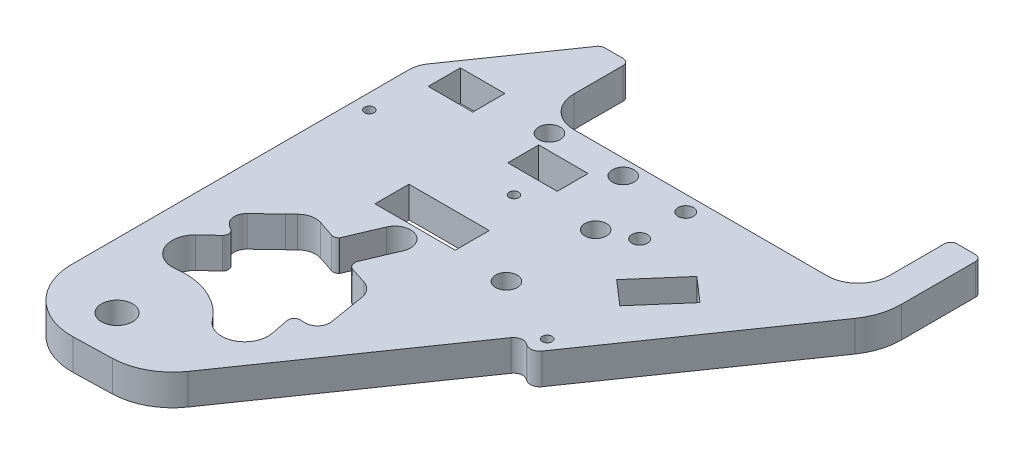
from build123d import *

# Parameters (mm, degrees)
DODANIE_WYCI_GNI_CIE1_DEPTH = 10
SZKIC5_R                    = 5.05
WYTNIJ_WYCI_GNI_CIE1_DEPTH  = 10
SZKIC9_R                    = 1.55
SZKIC9_W                    = 26
SZKIC9_H                    = 11
SZKIC9_W_2                  = 16
SZKIC9_H_2                  = 10
WYTNIJ_WYCI_GNI_CIE3_DEPTH  = 172.424567808
SZKIC13_R                   = 3.5
WYTNIJ_WYCI_GNI_CIE5_DEPTH  = 172.424567808
SZKIC19_W                   = 14.4
SZKIC19_H                   = 10.4
WYTNIJ_WYCI_GNI_CIE7_DEPTH  = 172.424567808
SZKIC20_R                   = 1.550000003
WYTNIJ_WYCI_GNI_CIE8_DEPTH  = 10
WYTNIJ_WYCI_GNI_CIE10_DEPTH = 10
WYTNIJ_WYCI_GNI_CIE11_DEPTH = 10
DODANIE_WYCI_GNI_CIE4_DEPTH = 10
SZKIC22_R                   = 1.55
WYTNIJ_WYCI_GNI_CIE9_DEPTH  = 10
WYTNIJ_WYCI_GNI_CIE6_DEPTH  = 172.424567808
WYTNIJ_WYCI_GNI_CIE12_DEPTH = 10
SZKIC30_R                   = 2.5
WYTNIJ_WYCI_GNI_CIE13_DEPTH = 10
WYTNIJ_WYCI_GNI_CIE14_DEPTH = 10


with BuildPart() as part:
    # Szkic2 → Dodanie-wyciągnięcie1 (new body)
    with BuildSketch(Plane(origin=(0, 0, 0), x_dir=(1, 0, 0), z_dir=(0, 1, 0))):
        with BuildLine():
            Line((-2.705874152, 127.916025413), (-8.705874152, 127.916025413))
            Line((-8.705874152, 127.916025413), (-8.722327105, 127.916025413))
            ThreePointArc((-8.722327105, 127.916025413), (-9.649740147, 127.688003136), (-10.365682355, 127.055930463))
            Line((-10.365682355, 127.055930463), (-32.779295153, 94.743126616))
            ThreePointArc((-32.779295153, 94.743126616), (-33.840904211, 92.57229607), (-34.205874152, 90.183506419))
            Line((-34.205874152, 90.183506419), (-34.205874152, -19.154356935))
            ThreePointArc((-34.205874152, -19.154356935), (-28.165753637, -33.476429577), (-13.693697675, -39.147797741))
            Line((-13.693697675, -39.147797741), (-2.713579886, -35.93445679))
            Line((-2.713579886, -35.93445679), (55.027168237, 21.545915465))
            ThreePointArc((55.027168237, 21.545915465), (56.334805154, 23.495770338), (56.794125848, 25.798132784))
            Line((56.794125848, 25.798132784), (56.794125848, 59.333926751))
            ThreePointArc((56.794125848, 59.333926751), (64.677605901, 81.048439594), (85.935948442, 90.090131813))
            Line((85.935948442, 90.090131813), (91.371133341, 90.090131813))
            ThreePointArc((91.371133341, 90.090131813), (105.458816444, 95.925441216), (111.294125848, 110.013124319))
            Line((111.294125848, 110.013124319), (111.294125848, 118.285035843))
            Line((111.294125848, 118.285035843), (111.294125848, 128))
            ThreePointArc((111.294125848, 128), (110.70833941, 129.414213562), (109.294125848, 130))
            Line((109.294125848, 130), (103.294125848, 130))
            ThreePointArc((103.294125848, 130), (101.879912285, 129.414213562), (101.294125848, 128))
            Line((101.294125848, 128), (101.294125848, 118.285035843))
            Line((101.294125848, 118.285035843), (101.294125848, 110))
            ThreePointArc((101.294125848, 110), (98.36519366, 102.928932188), (91.294125848, 100))
            Line((91.294125848, 100), (9.294125848, 100))
            ThreePointArc((9.294125848, 100), (2.223058036, 102.928932188), (-0.705874152, 110))
            Line((-0.705874152, 110), (-0.705874152, 125.916025413))
            ThreePointArc((-0.705874152, 125.916025413), (-1.291660589, 127.330238976), (-2.705874152, 127.916025413))
        make_face()
    extrude(amount=DODANIE_WYCI_GNI_CIE1_DEPTH)

    # Szkic5 → Wytnij-wyciągnięcie1 (cut)
    with BuildSketch(Plane(origin=(0, 10, 0), x_dir=(1, 0, 0), z_dir=(0, 1, 0))):
        with Locations(Location((-13.29618586, -25.303913492, 0), (0, 0, 270))):
            Circle(SZKIC5_R)
    extrude(amount=-WYTNIJ_WYCI_GNI_CIE1_DEPTH, mode=Mode.SUBTRACT)

    # Szkic9 → Wytnij-wyciągnięcie3 (cut, through all)
    with BuildSketch(Plane(origin=(0, 10, 0), x_dir=(1, 0, 0), z_dir=(0, 1, 0))):
        with Locations(Location((17.894125848, 72, 0), (0, 0, 270))):
            Circle(SZKIC9_R)
        with Locations((10.894125848, 52.5)):
            Rectangle(SZKIC9_W, SZKIC9_H)
        with Locations((15.894125848, 85)):
            Rectangle(SZKIC9_W_2, SZKIC9_H_2)
    extrude(amount=-WYTNIJ_WYCI_GNI_CIE3_DEPTH, mode=Mode.SUBTRACT)

    # Szkic13 → Wytnij-wyciągnięcie5 (cut, through all)
    with BuildSketch(Plane(origin=(0, 10, 0), x_dir=(1, 0, 0), z_dir=(0, 1, 0))):
        with Locations(Location((40.894125848, 75.45, 0), (0, 0, 270))):
            Circle(SZKIC13_R)
        with Locations(Location((40.894125848, 46.55, 0), (0, 0, 270))):
            Circle(SZKIC13_R)
        with Locations(Location((30.260526653, 95, 0), (0, 0, 270))):
            Circle(SZKIC13_R)
        with Locations(Location((6.36054282, 95, 0), (0, 0, 270))):
            Circle(SZKIC13_R)
    extrude(amount=-WYTNIJ_WYCI_GNI_CIE5_DEPTH, mode=Mode.SUBTRACT)

    # Szkic19 → Wytnij-wyciągnięcie7 (cut, through all)
    with BuildSketch(Plane(origin=(0, 10, 0), x_dir=(1, 0, 0), z_dir=(0, 1, 0))):
        with Locations((-19.205874152, 93.746086503)):
            Rectangle(SZKIC19_W, SZKIC19_H)
    extrude(amount=-WYTNIJ_WYCI_GNI_CIE7_DEPTH, mode=Mode.SUBTRACT)

    # Szkic20 → Wytnij-wyciągnięcie8 (cut)
    with BuildSketch(Plane.XZ):
        with Locations(Location((-29.337186678, -72.387878862, 0), (0, 0, 270))):
            Circle(SZKIC20_R)
    extrude(amount=-WYTNIJ_WYCI_GNI_CIE8_DEPTH, mode=Mode.SUBTRACT)

    # Szkic23 → Wytnij-wyciągnięcie10 (cut)
    with BuildSketch(Plane(origin=(0, 10, 0), x_dir=(1, 0, 0), z_dir=(0, 1, 0))):
        with BuildLine():
            Line((15.628724602, 38.350669498), (8.597420665, 21.889479841))
            Line((8.597420665, 21.889479841), (-0.782698582, 25.896144654))
            Line((-0.782698582, 25.896144654), (6.248605356, 42.357334312))
            ThreePointArc((6.248605356, 42.357334312), (12.941997386, 45.044061528), (15.628724602, 38.350669498))
        make_face()
    extrude(amount=-WYTNIJ_WYCI_GNI_CIE10_DEPTH, mode=Mode.SUBTRACT)

    # Szkic25 → Wytnij-wyciągnięcie11 (cut)
    with BuildSketch(Plane(origin=(0, 10, 0), x_dir=(1, 0, 0), z_dir=(0, 1, 0))):
        with BuildLine():
            Line((1.679385524, 31.66020119), (3.469714538, 35.85159239))
            Line((3.469714538, 35.85159239), (3.704708682, 36.109613041))
            ThreePointArc((3.704708682, 36.109613041), (9.518980065, 39.386499344), (13.410780858, 33.964541935))
            Line((13.410780858, 33.964541935), (13.39199801, 33.114203976))
            Line((13.39199801, 33.114203976), (12.051775457, 29.976570072))
            Line((12.051775457, 29.976570072), (11.05950477, 27.653536376))
            Line((11.05950477, 27.653536376), (17.589964961, -6.167500607))
            ThreePointArc((17.589964961, -6.167500607), (13.061179445, -14.403704543), (4.044681841, -11.748949479))
            ThreePointArc((4.044681841, -11.748949479), (-4.827370085, -4.988355381), (-15.874459375, -3.445385461))
            ThreePointArc((-15.874459375, -3.445385461), (-23.818044234, 0.469833912), (-22.492396316, 9.226096856))
            Line((-22.492396316, 9.226096856), (1.679385524, 31.66020119))
        make_face()
    extrude(amount=-WYTNIJ_WYCI_GNI_CIE11_DEPTH, mode=Mode.SUBTRACT)

    # Szkic27 → Dodanie-wyciągnięcie4 (add)
    with BuildSketch(Plane.XZ):
        with BuildLine():
            Line((111.294125848, -110.013124319), (91.371133341, -90.090131813))
            Line((91.371133341, -90.090131813), (85.935948442, -90.090131813))
            ThreePointArc((85.935948442, -90.090131813), (64.677605901, -81.048439594), (56.794125848, -59.333926751))
            Line((56.794125848, -59.333926751), (56.794125848, -25.798132784))
            Line((56.794125848, -25.798132784), (55.027168237, -21.545915465))
            Line((55.027168237, -21.545915465), (-2.713579886, 35.93445679))
            Line((-2.713579886, 35.93445679), (-13.693697675, 39.147797741))
            Line((-13.693697675, 39.147797741), (7.831109821, 38.596391899))
            ThreePointArc((7.831109821, 38.596391899), (16.200857661, 35.992910672), (22.653502952, 30.060443886))
            Line((22.653502952, 30.060443886), (62.775344571, -27.781601032))
            Line((62.775344571, -27.781601032), (89.166132073, -65.828137643))
            Line((89.166132073, -65.828137643), (107.72767835, -92.58757216))
            ThreePointArc((107.72767835, -92.58757216), (110.381700996, -98.014648527), (111.294125848, -103.986622655))
            Line((111.294125848, -103.986622655), (111.294125848, -110.013124319))
        make_face()
    extrude(amount=-DODANIE_WYCI_GNI_CIE4_DEPTH)

    # Szkic22 → Wytnij-wyciągnięcie9 (cut)
    with BuildSketch(Plane.XZ):
        with Locations(Location((63.668699874, -36.964909883, 0), (0, 0, 270))):
            Circle(SZKIC22_R)
    extrude(amount=-WYTNIJ_WYCI_GNI_CIE9_DEPTH, mode=Mode.SUBTRACT)

    # Szkic17 → Wytnij-wyciągnięcie6 (cut, through all)
    with BuildSketch(Plane(origin=(0, 10, 0), x_dir=(1, 0, 0), z_dir=(0, 1, 0))):
        Polygon((66.124221849, 58.029118396), (78.203911754, 71.908638986), (70.358965334, 78.736289802), (58.279275429, 64.856769212), align=None)
    extrude(amount=-WYTNIJ_WYCI_GNI_CIE6_DEPTH, mode=Mode.SUBTRACT)

    # Szkic28 → Wytnij-wyciągnięcie12 (cut)
    with BuildSketch(Plane(origin=(0, 10, 0), x_dir=(1, 0, 0), z_dir=(0, 1, 0))):
        with BuildLine():
            Line((11.26748333, 26.576422306), (10.066738772, 23.271111531))
            Line((10.066738772, 23.271111531), (13.650053515, 4.713243184))
            Line((13.650053515, 4.713243184), (14.443246416, -0.151068703))
            Line((14.443246416, -0.151068703), (16.401806069, -0.01406507))
            ThreePointArc((16.401806069, -0.01406507), (16.908780733, 1.735462564), (18.624084966, 2.348326041))
            ThreePointArc((18.624084966, 2.348326041), (19.396162916, 2.285491306), (20.170698513, 2.297622868))
            Line((20.170698513, 2.297622868), (20.24930544, 2.302668096))
            ThreePointArc((20.24930544, 2.302668096), (23.123159184, 3.803925799), (23.940405993, 6.941586981))
            Line((23.940405993, 6.941586981), (23.056429184, 12.118910521))
            Line((23.056429184, 12.118910521), (22.000864003, 18.666304586))
            ThreePointArc((22.000864003, 18.666304586), (20.623069051, 21.574602066), (17.93652414, 23.346321457))
            Line((17.93652414, 23.346321457), (12.620467249, 25.051129714))
            ThreePointArc((12.620467249, 25.051129714), (11.735014139, 25.628420704), (11.26748333, 26.576422306))
        make_face()
        with BuildLine():
            Line((-0.358990635, 31.193922826), (-5.655504297, 32.95851204))
            ThreePointArc((-5.655504297, 32.95851204), (-8.869808875, 33.115862726), (-11.699467807, 31.583040659))
            Line((-11.699467807, 31.583040659), (-13.721552832, 29.619702325))
            Line((-13.721552832, 29.619702325), (-20.075654798, 23.596300827))
            ThreePointArc((-20.075654798, 23.596300827), (-21.322767717, 20.6033893), (-19.942342747, 17.669580012))
            Line((-19.942342747, 17.669580012), (-19.882798357, 17.618014821))
            ThreePointArc((-19.882798357, 17.618014821), (-19.179679353, 17.074421967), (-18.420602931, 16.612174728))
            ThreePointArc((-18.420602931, 16.612174728), (-17.380074633, 15.099249316), (-18.012101151, 13.375246728))
            Line((-18.012101151, 13.375246728), (-18.878230506, 12.580445054))
            Line((-18.878230506, 12.580445054), (-17.460533124, 11.447059157))
            Line((-17.460533124, 11.447059157), (-13.203312435, 15.39161053))
            Line((-13.203312435, 15.39161053), (0.650139771, 28.249156335))
            Line((0.650139771, 28.249156335), (1.63370973, 31.625464518))
            ThreePointArc((1.63370973, 31.625464518), (0.696479646, 31.136698863), (-0.358990635, 31.193922826))
        make_face()
    extrude(amount=-WYTNIJ_WYCI_GNI_CIE12_DEPTH, mode=Mode.SUBTRACT)

    # Szkic30 → Wytnij-wyciągnięcie13 (cut)
    with BuildSketch(Plane.XZ):
        with Locations(Location((50.565790387, -80.001305931, 0), (0, 0, 270))):
            Circle(SZKIC30_R)
        with Locations(Location((50.48451947, -95.001085764, 0), (0, 0, 270))):
            Circle(SZKIC30_R)
    extrude(amount=-WYTNIJ_WYCI_GNI_CIE13_DEPTH, mode=Mode.SUBTRACT)

    # Szkic31 → Wytnij-wyciągnięcie14 (cut)
    with BuildSketch(Plane.XZ):
        with BuildLine():
            Line((14.621138887, 30.235921356), (57.465724426, -31.531393932))
            ThreePointArc((57.465724426, -31.531393932), (59.396767725, -32.773629705), (61.640614875, -32.286569233))
            Line((61.640614875, -32.286569233), (62.051453688, -32.00159297))
            ThreePointArc((62.051453688, -32.00159297), (64.295300838, -31.514532498), (66.226344137, -32.756768271))
            Line((66.226344137, -32.756768271), (22.653502952, 30.060443886))
            ThreePointArc((22.653502952, 30.060443886), (16.200857661, 35.992910672), (7.831109821, 38.596391899))
            Line((7.831109821, 38.596391899), (-1.300237138, 38.830311667))
            ThreePointArc((-1.300237138, 38.830311667), (7.687866321, 36.436435661), (14.621138887, 30.235921356))
        make_face()
    extrude(amount=-WYTNIJ_WYCI_GNI_CIE14_DEPTH, mode=Mode.SUBTRACT)


solid = part.part
